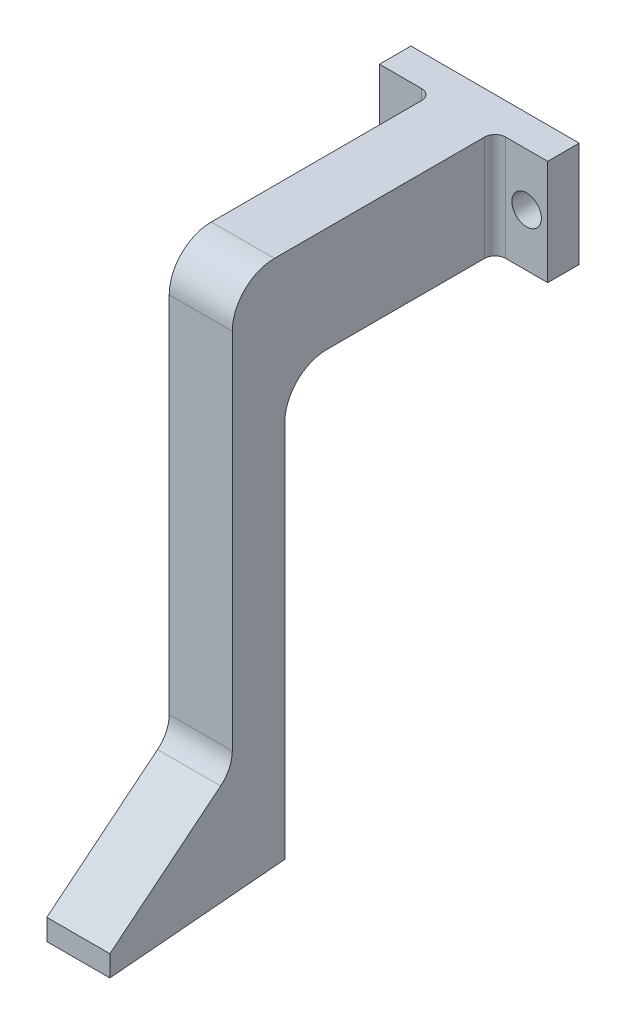
from build123d import *

# Parameters (mm, degrees)
SKETCH3_W           = 20.32
SKETCH3_H           = 12.7
BOSS_EXTRUDE1_DEPTH = 3.81
SKETCH4_R           = 1.778
CUT_EXTRUDE1_DEPTH  = 3.81
SKETCH5_W           = 7.62
SKETCH5_H           = 12.7
BOSS_EXTRUDE2_DEPTH = 25.4
FILLET1_R           = 1.27
FILLET2_R           = 1.27
BOSS_EXTRUDE6_DEPTH = 7.62
FILLET5_R           = 5.08
FILLET6_R           = 5.08
FILLET7_R           = 3.81


with BuildPart() as part:
    # Sketch3 → Boss-Extrude1 (new body)
    with BuildSketch(Plane.XY):
        Rectangle(SKETCH3_W, SKETCH3_H)
    extrude(amount=BOSS_EXTRUDE1_DEPTH)

    # Sketch4 → Cut-Extrude1 (cut)
    with BuildSketch(Plane.XY.offset(3.81)):
        with Locations((-7.62, 0)):
            Circle(SKETCH4_R)
        with Locations((7.62, 0)):
            Circle(SKETCH4_R)
    extrude(amount=-CUT_EXTRUDE1_DEPTH, mode=Mode.SUBTRACT)

    # Sketch5 → Boss-Extrude2 (add)
    with BuildSketch(Plane.XY.offset(3.81)):
        Rectangle(SKETCH5_W, SKETCH5_H)
    extrude(amount=BOSS_EXTRUDE2_DEPTH)

    # Fillet1
    fillet1_edges = [part.edges().sort_by_distance(p)[0] for p in [
        (-3.81, 0, 3.81),
    ]]
    fillet(fillet1_edges, radius=FILLET1_R)

    # Fillet2
    fillet2_edges = [part.edges().sort_by_distance(p)[0] for p in [
        (3.81, 0, 3.81),
    ]]
    fillet(fillet2_edges, radius=FILLET2_R)

    # Sketch10 → Boss-Extrude6 (add)
    with BuildSketch(Plane.ZY.offset(3.81)):
        Polygon((29.21, 6.35), (29.21, -57.15), (50.347792279, -58.999317196), (50.347792279, -56.459317196), (35.56, -44.45), (35.56, 6.35), align=None)
    extrude(amount=-BOSS_EXTRUDE6_DEPTH)

    # Fillet5
    fillet5_edges = [part.edges().sort_by_distance(p)[0] for p in [
        (0, -6.35, 29.21),
    ]]
    fillet(fillet5_edges, radius=FILLET5_R)

    # Fillet6
    fillet6_edges = [part.edges().sort_by_distance(p)[0] for p in [
        (0, 6.35, 35.56),
    ]]
    fillet(fillet6_edges, radius=FILLET6_R)

    # Fillet7
    fillet7_edges = [part.edges().sort_by_distance(p)[0] for p in [
        (0, -44.45, 35.56),
    ]]
    fillet(fillet7_edges, radius=FILLET7_R)


solid = part.part
